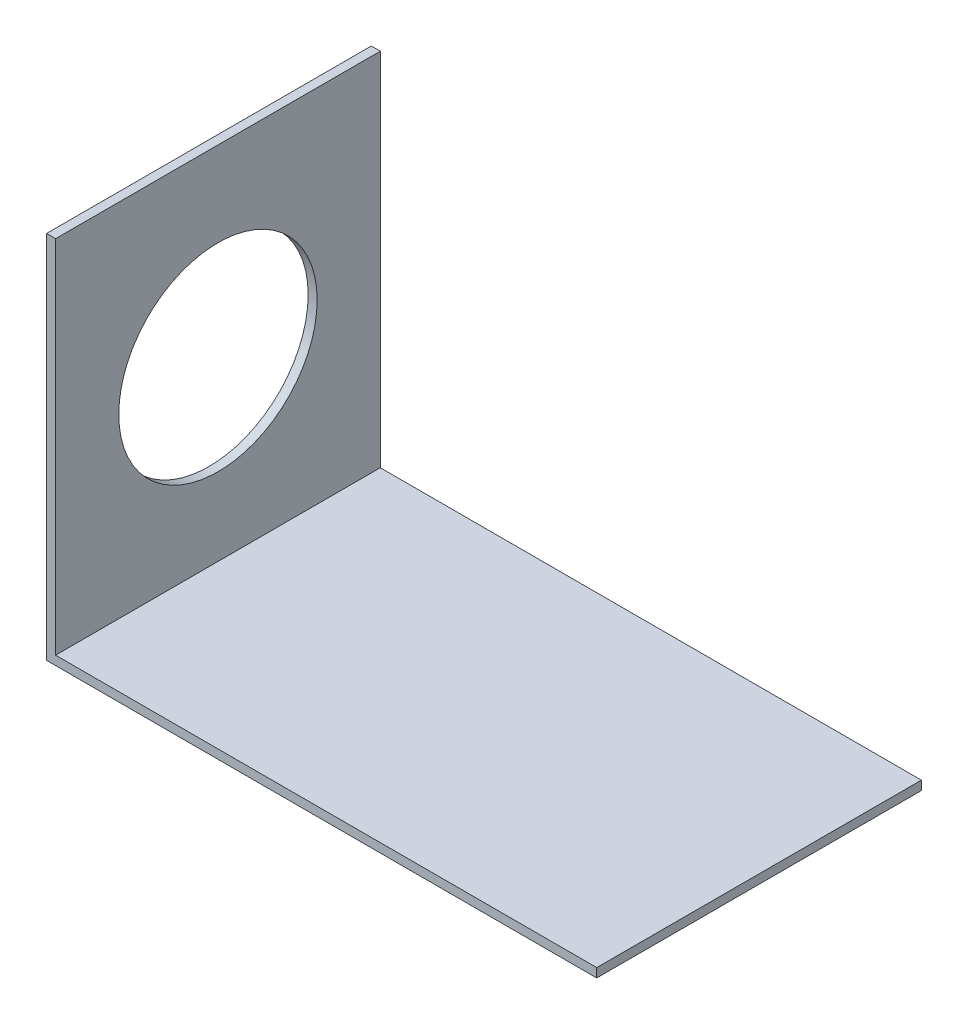
from build123d import *

# Parameters (mm, degrees)
BOSS_EXTRUDE1_DEPTH = 36
SKETCH2_R           = 11
CUT_EXTRUDE1_DEPTH  = 40


with BuildPart() as part:
    # Sketch1 → Boss-Extrude1 (new body)
    with BuildSketch(Plane.XY):
        Polygon((-74.853976105, 40), (-74.853976105, 0), (-14.853976105, 0), (-14.853976105, -1), (-75.853976105, -1), (-75.853976105, 40), align=None)
    extrude(amount=BOSS_EXTRUDE1_DEPTH)

    # Sketch2 → Cut-Extrude1 (cut)
    with BuildSketch(Plane(origin=(-74.853976105, 0, 0), x_dir=(0, 0, -1), z_dir=(1, 0, 0))):
        with Locations((-18, 19.61)):
            Circle(SKETCH2_R)
    extrude(amount=-CUT_EXTRUDE1_DEPTH, mode=Mode.SUBTRACT)


solid = part.part
